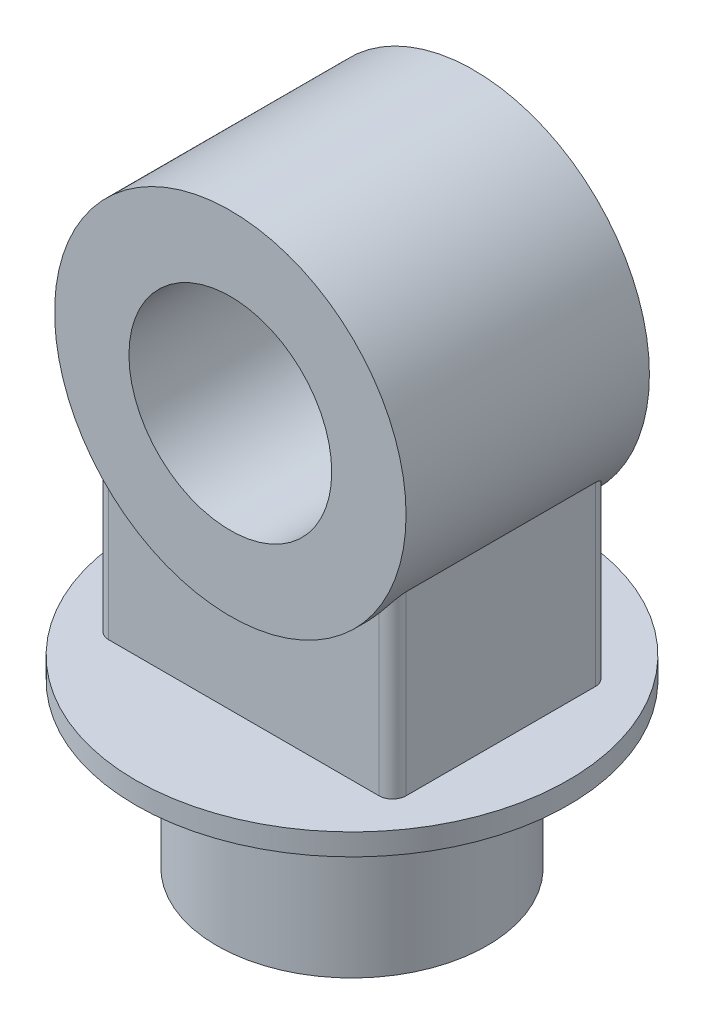
from build123d import *

# Parameters (mm, degrees)
IZIM1_R                          = 100
Y_KSEKLIK_EKSTR_ZYON1_DEPTH      = 120
IZIM2_R                          = 160
Y_KSEKLIK_EKSTR_ZYON2_DEPTH      = 16
IZIM3_R                          = 130
IZIM3_R_2                        = 75
Y_KSEKLIK_EKSTR_ZYON3_DEPTH      = 90
Y_KSEKLIK_EKSTR_ZYON4_REACH      = 402.125
Y_KSEKLIK_EKSTR_ZYON4_END_RADIUS = 130
IZIM4_W                          = 220
IZIM4_H                          = 160
RADYUS1_R                        = 10


with BuildPart() as part:
    # Çizim1 → Yükseklik-Ekstrüzyon1 (new body)
    with BuildSketch(Plane(origin=(0, 0, 0), x_dir=(1, 0, 0), z_dir=(0, 1, 0))):
        with Locations(Location((0, 0, 0), (0, 0, 270))):
            Circle(IZIM1_R)
    extrude(amount=Y_KSEKLIK_EKSTR_ZYON1_DEPTH)

    # Çizim2 → Yükseklik-Ekstrüzyon2 (add)
    with BuildSketch(Plane(origin=(0, 120, 0), x_dir=(1, 0, 0), z_dir=(0, 1, 0))):
        with Locations(Location((0, 0, 0), (0, 0, 270))):
            Circle(IZIM2_R)
    extrude(amount=Y_KSEKLIK_EKSTR_ZYON2_DEPTH)



with BuildPart() as body_2:
    # Çizim3 → Yükseklik-Ekstrüzyon3 (new, symmetric)
    with BuildSketch(Plane.XY):
        with Locations((0, 336)):
            Circle(IZIM3_R)
        with Locations((0, 336)):
            Circle(IZIM3_R_2, mode=Mode.SUBTRACT)
    extrude(amount=Y_KSEKLIK_EKSTR_ZYON3_DEPTH, both=True)


with BuildPart() as part_1:
    add(part.part)

    add(body_2.part)  # Yükseklik-Ekstrüzyon4 merges body 2
    # Yükseklik-Ekstrüzyon4: up to this cylinder (the profile starts outside it)
    y_kseklik_ekstr_zyon4_end = Plane(origin=(0, 336, 0), z_dir=(0, 0, 1)) * Cylinder(Y_KSEKLIK_EKSTR_ZYON4_END_RADIUS, 1065.25, mode=Mode.PRIVATE)
    # Çizim4 → Yükseklik-Ekstrüzyon4 (add, up to the surface)
    with BuildSketch(Plane(origin=(0, 136, 0), x_dir=(1, 0, 0), z_dir=(0, 1, 0)), mode=Mode.PRIVATE) as y_kseklik_ekstr_zyon4_sk1:
        Rectangle(IZIM4_W, IZIM4_H)
    y_kseklik_ekstr_zyon4_tool1 = extrude(y_kseklik_ekstr_zyon4_sk1.sketch, amount=Y_KSEKLIK_EKSTR_ZYON4_REACH, mode=Mode.PRIVATE) - y_kseklik_ekstr_zyon4_end
    add(y_kseklik_ekstr_zyon4_tool1.solids().sort_by_distance((0, 136, 0))[0])

    # Radyus1
    radyus1_edges = [part_1.edges().sort_by_distance(p)[0] for p in [
        (110, 201.358983849, -80),
        (-110, 201.358983849, -80),
        (110, 201.358983849, 80),
        (-110, 201.358983849, 80),
    ]]
    fillet(radyus1_edges, radius=RADYUS1_R)


solid = part_1.part
